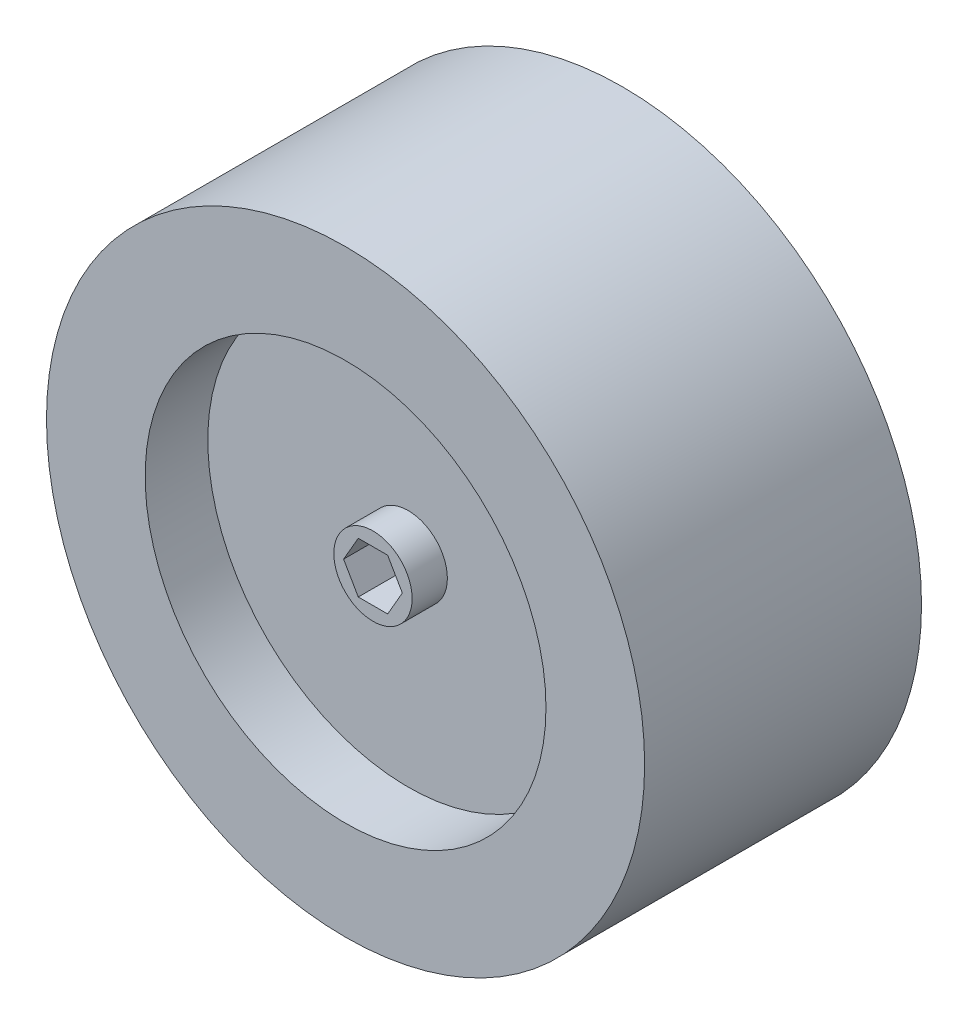
from build123d import *

# Parameters (mm, degrees)
SKETCH2_R                      = 48.5
BOSS_EXTRUDE1_DEPTH            = 22.45
SKETCH3_R                      = 32.5
CUT_EXTRUDE1_DEPTH             = 10.16
SKETCH9_R                      = 6.35
BOSS_EXTRUDE2_DEPTH            = 5.715
CUT_EXTRUDE2_DEPTH             = 77.885418644
CUT_EXTRUDE2_DEPTH_BACK        = 22.1
M5_CLEARANCE_HOLE1_D           = 5.5
M5_CLEARANCE_HOLE1_CSINK_D     = 5.55
M5_CLEARANCE_HOLE1_CSINK_ANGLE = 90
SKETCH8_R                      = 3.81
CUT_EXTRUDE3_DEPTH             = 8.255
SKETCH10_R                     = 25.4
CUT_EXTRUDE4_DEPTH             = 3.175


with BuildPart() as part:
    # Sketch2 → Boss-Extrude1 (new, symmetric)
    with BuildSketch(Plane.XY):
        Circle(SKETCH2_R)
    extrude(amount=BOSS_EXTRUDE1_DEPTH, both=True)

    # Sketch3 → Cut-Extrude1 (cut)
    with BuildSketch(Plane.XY.offset(22.45)):
        Circle(SKETCH3_R)
    extrude(amount=-CUT_EXTRUDE1_DEPTH, mode=Mode.SUBTRACT)

    # Sketch9 → Boss-Extrude2 (add)
    with BuildSketch(Plane.XY.offset(12.29)):
        Circle(SKETCH9_R)
    extrude(amount=BOSS_EXTRUDE2_DEPTH)

    # Sketch4 → Cut-Extrude2 (cut, two sides: drawn at the far end of the back side and taken through both)
    with BuildSketch(Plane.XY.offset(12.29).offset(-CUT_EXTRUDE2_DEPTH_BACK)):
        Polygon((2.38156986, 4.125), (-2.38156986, 4.125), (-4.763139721, 0), (-2.38156986, -4.125), (2.38156986, -4.125), (4.763139721, 0), align=None)
    extrude(amount=CUT_EXTRUDE2_DEPTH + CUT_EXTRUDE2_DEPTH_BACK, mode=Mode.SUBTRACT)

    # M5 Clearance Hole1 (through all)
    with Locations(Plane.XY.offset(-9.81)):
        with Locations((0, 0)):
            CounterSinkHole(M5_CLEARANCE_HOLE1_D / 2, M5_CLEARANCE_HOLE1_CSINK_D / 2, counter_sink_angle=M5_CLEARANCE_HOLE1_CSINK_ANGLE)

    # Sketch8 → Cut-Extrude3 (cut)
    with BuildSketch(Plane(origin=(0, 0, -22.45), x_dir=(-1, 0, 0), z_dir=(0, 0, -1))):
        Circle(SKETCH8_R)
    extrude(amount=-CUT_EXTRUDE3_DEPTH, mode=Mode.SUBTRACT)

    # Sketch10 → Cut-Extrude4 (cut)
    with BuildSketch(Plane(origin=(0, 0, -22.45), x_dir=(-1, 0, 0), z_dir=(0, 0, -1))):
        Circle(SKETCH10_R)
    extrude(amount=-CUT_EXTRUDE4_DEPTH, mode=Mode.SUBTRACT)


solid = part.part
